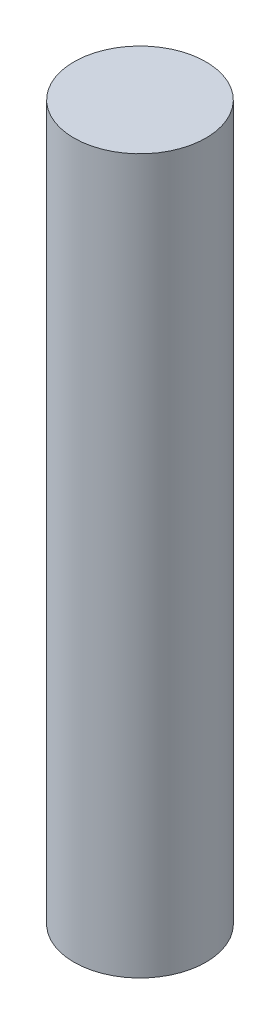
from build123d import *

# Parameters (mm, degrees)
SKETCH1_R           = 0.925
BOSS_EXTRUDE1_DEPTH = 10


with BuildPart() as part:
    # Sketch1 → Boss-Extrude1 (new body)
    with BuildSketch(Plane(origin=(0, 0, 0), x_dir=(1, 0, 0), z_dir=(0, 1, 0))):
        with Locations(Location((0, 0, 0), (0, 0, 270))):
            Circle(SKETCH1_R)
    extrude(amount=BOSS_EXTRUDE1_DEPTH)


solid = part.part
